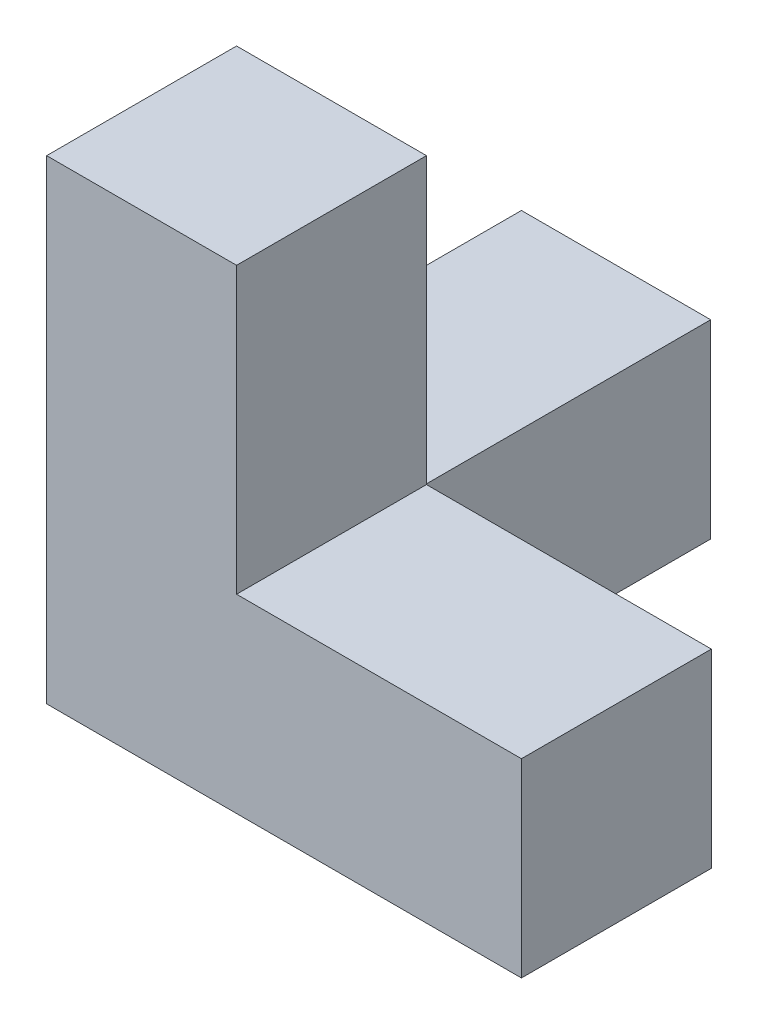
from build123d import *

# Parameters (mm, degrees)
ESQUISSE2_W                  = 50
ESQUISSE2_H                  = 50
BOSS_EXTRU_1_DEPTH           = 50
ENL_V_MAT_EXTRU_1_DEPTH      = 129.695677467
ENL_V_MAT_EXTRU_1_DEPTH_BACK = 50
ENL_V_MAT_EXTRU_2_DEPTH      = 129.695677467
ENL_V_MAT_EXTRU_2_DEPTH_BACK = 30
ENL_V_MAT_EXTRU_3_DEPTH      = 129.695677467
ENL_V_MAT_EXTRU_3_DEPTH_BACK = 30


with BuildPart() as part:
    # Esquisse2 → Boss.-Extru.1 (new body)
    with BuildSketch(Plane.XY):
        with Locations((-84.722222222, 19.984567901)):
            Rectangle(ESQUISSE2_W, ESQUISSE2_H)
    extrude(amount=BOSS_EXTRU_1_DEPTH)

    # Esquisse3 → Enlèv. mat.-Extru.1 (cut, two sides: drawn at the far end of the back side and taken through both)
    with BuildSketch(Plane.XY.offset(50).offset(-ENL_V_MAT_EXTRU_1_DEPTH_BACK)):
        Polygon((-89.722222222, 171.603605798), (-89.722222222, 44.984567901), (-89.722222222, 14.984567901), (-59.722222222, 14.984567901), (66.896815675, 14.984567901), (245.963176323, 194.05092855), (89.344138426, 350.669966447), align=None)
    extrude(amount=ENL_V_MAT_EXTRU_1_DEPTH + ENL_V_MAT_EXTRU_1_DEPTH_BACK, mode=Mode.SUBTRACT)

    # Esquisse4 → Enlèv. mat.-Extru.2 (cut, two sides: drawn at the far end of the back side and taken through both)
    with BuildSketch(Plane(origin=(0, 0, 0), x_dir=(-1, 0, 0), z_dir=(0, 0, -1)).offset(-ENL_V_MAT_EXTRU_2_DEPTH_BACK)):
        Polygon((-36.896815675, 14.984567901), (89.722222222, 14.984567901), (109.722222222, 14.984567901), (236.341260119, 14.984567901), (236.341260119, 268.222643695), (-36.896815675, 268.222643695), align=None)
    extrude(amount=ENL_V_MAT_EXTRU_2_DEPTH + ENL_V_MAT_EXTRU_2_DEPTH_BACK, mode=Mode.SUBTRACT)

    # Esquisse5 → Enlèv. mat.-Extru.3 (cut, two sides: drawn at the far end of the back side and taken through both)
    with BuildSketch(Plane(origin=(0, 0, 0), x_dir=(-1, 0, 0), z_dir=(0, 0, -1)).offset(-ENL_V_MAT_EXTRU_3_DEPTH_BACK)):
        Polygon((89.792498294, 141.675981519), (89.792498294, 14.984567901), (89.792498294, -5.015432099), (89.792498294, -131.706845716), (-163.590328941, -131.706845716), (-163.590328941, 141.675981519), align=None)
    extrude(amount=ENL_V_MAT_EXTRU_3_DEPTH + ENL_V_MAT_EXTRU_3_DEPTH_BACK, mode=Mode.SUBTRACT)


solid = part.part
